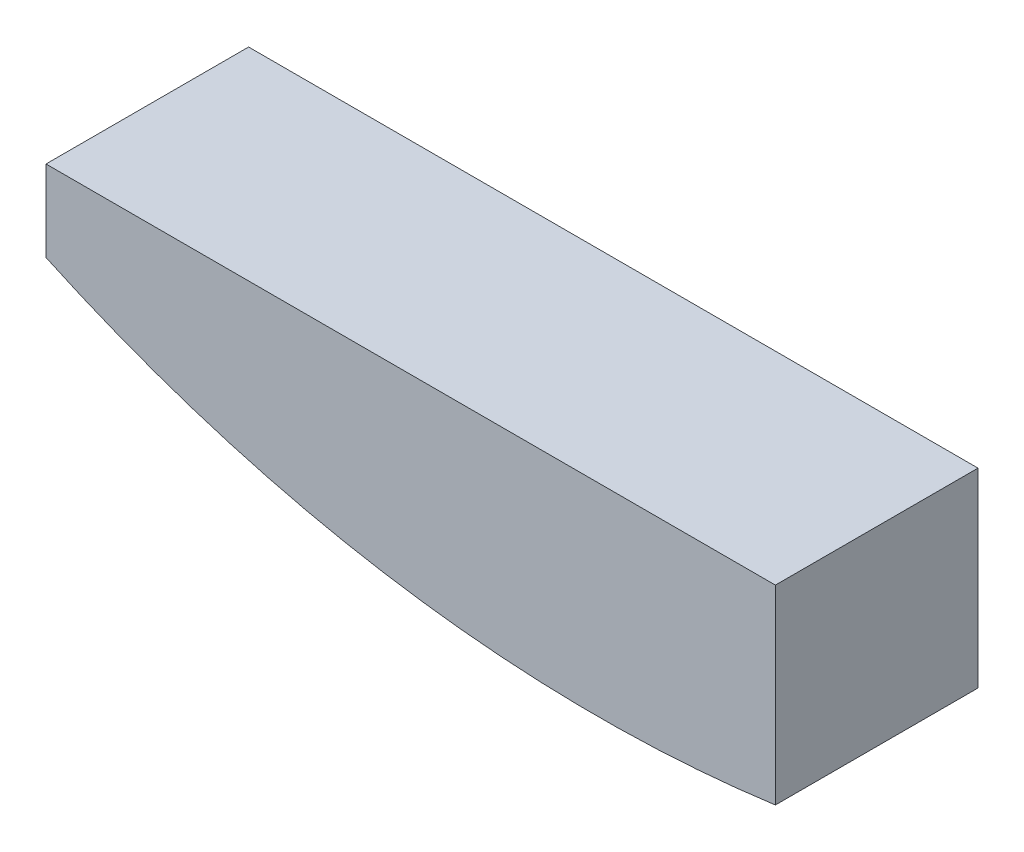
from build123d import *

# Parameters (mm, degrees)
SKETCH2_W           = 18
SKETCH2_H           = 5
BOSS_EXTRUDE1_DEPTH = 5
CUT_EXTRUDE1_DEPTH  = 20.339079606
SKETCH4_W           = 18
SKETCH4_H           = 5
BOSS_EXTRUDE2_DEPTH = 2


with BuildPart() as part:
    # Sketch2 → Boss-Extrude1 (new body)
    with BuildSketch(Plane(origin=(0, 0, 0), x_dir=(1, 0, 0), z_dir=(0, 1, 0))):
        with Locations((9, 2.5)):
            Rectangle(SKETCH2_W, SKETCH2_H)
    extrude(amount=BOSS_EXTRUDE1_DEPTH)

    # Sketch3 → Cut-Extrude1 (cut, through all)
    with BuildSketch(Plane.XY):
        with BuildLine():
            Line((0, 5), (0, 0))
            Line((0, 0), (18, 0))
            Line((18, 0), (18, 2.3))
            ThreePointArc((18, 2.3), (8.806182909, 2.357886062), (0, 5))
        make_face()
    extrude(amount=-CUT_EXTRUDE1_DEPTH, mode=Mode.SUBTRACT)

    # Sketch4 → Boss-Extrude2 (add)
    with BuildSketch(Plane(origin=(0, 5, 0), x_dir=(1, 0, 0), z_dir=(0, 1, 0))):
        with Locations((9, 2.5)):
            Rectangle(SKETCH4_W, SKETCH4_H)
    extrude(amount=BOSS_EXTRUDE2_DEPTH)


solid = part.part
